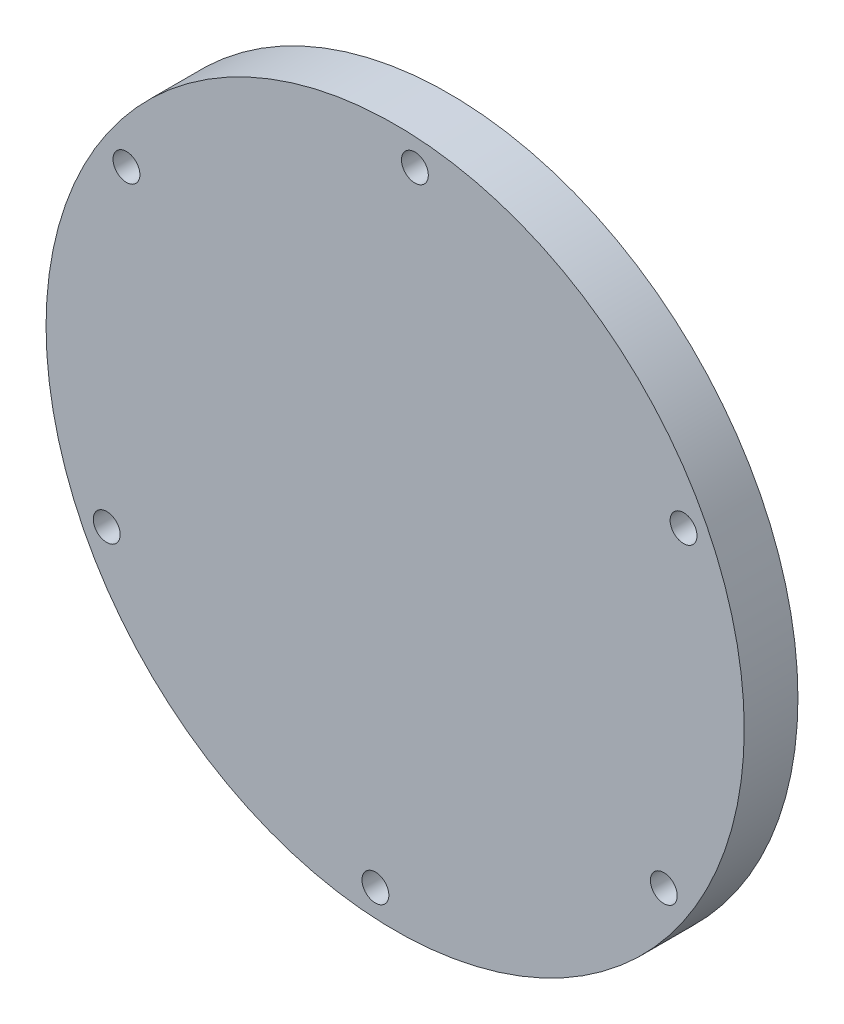
from build123d import *

# Parameters (mm, degrees)
SKETCH_1_R          = 65
SKETCH_1_R_2        = 60
SKETCH_1_R_3        = 55
EXTRUDE_1_DEPTH     = 10
CUT_EXTRUDE_1_REACH = 94.466
SKETCH_2_R          = 2.5
SKETCH_3_R          = 4
SKETCH_3_R_2        = 2.5
CUT_EXTRUDE_2_DEPTH = 5


with BuildPart() as part:
    # 草图1 → 凸台-拉伸1 (new body)
    # profile 1 of 3: a face of its own
    with BuildSketch(Plane.XY):
        Circle(SKETCH_1_R)
        Circle(SKETCH_1_R_2, mode=Mode.SUBTRACT)
    # profile 2 of 3: a face of its own
    with BuildSketch(Plane.XY):
        Circle(SKETCH_1_R_2)
        Circle(SKETCH_1_R_3, mode=Mode.SUBTRACT)
    # profile 3 of 3: a face of its own
    with BuildSketch(Plane.XY):
        Circle(SKETCH_1_R_3)
    extrude(amount=EXTRUDE_1_DEPTH)

    # 草图2 → 切除-拉伸1 (cut, up to next)
    with BuildSketch(Plane(origin=(0, 0, 0), x_dir=(-1, 0, 0), z_dir=(0, 0, -1)), mode=Mode.PRIVATE) as cut_extrude_1_sk1:
        with Locations((-3.675520948, 59.887315399)):
            Circle(SKETCH_2_R)
    cut_extrude_1_tool1 = extrude(cut_extrude_1_sk1.sketch, amount=-CUT_EXTRUDE_1_REACH, mode=Mode.PRIVATE) & part.part
    # 草图2 → 切除-拉伸1 (cut, up to next)
    with BuildSketch(Plane(origin=(0, 0, 0), x_dir=(-1, 0, 0), z_dir=(0, 0, -1)), mode=Mode.PRIVATE) as cut_extrude_1_sk2:
        with Locations((50.026176026, 33.126752213)):
            Circle(SKETCH_2_R)
    cut_extrude_1_tool2 = extrude(cut_extrude_1_sk2.sketch, amount=-CUT_EXTRUDE_1_REACH, mode=Mode.PRIVATE) & part.part
    # 草图2 → 切除-拉伸1 (cut, up to next)
    with BuildSketch(Plane(origin=(0, 0, 0), x_dir=(-1, 0, 0), z_dir=(0, 0, -1)), mode=Mode.PRIVATE) as cut_extrude_1_sk3:
        with Locations((53.701696975, -26.760563186)):
            Circle(SKETCH_2_R)
    cut_extrude_1_tool3 = extrude(cut_extrude_1_sk3.sketch, amount=-CUT_EXTRUDE_1_REACH, mode=Mode.PRIVATE) & part.part
    # 草图2 → 切除-拉伸1 (cut, up to next)
    with BuildSketch(Plane(origin=(0, 0, 0), x_dir=(-1, 0, 0), z_dir=(0, 0, -1)), mode=Mode.PRIVATE) as cut_extrude_1_sk4:
        with Locations((3.675520948, -59.887315399)):
            Circle(SKETCH_2_R)
    cut_extrude_1_tool4 = extrude(cut_extrude_1_sk4.sketch, amount=-CUT_EXTRUDE_1_REACH, mode=Mode.PRIVATE) & part.part
    # 草图2 → 切除-拉伸1 (cut, up to next)
    with BuildSketch(Plane(origin=(0, 0, 0), x_dir=(-1, 0, 0), z_dir=(0, 0, -1)), mode=Mode.PRIVATE) as cut_extrude_1_sk5:
        with Locations((-50.026176026, -33.126752213)):
            Circle(SKETCH_2_R)
    cut_extrude_1_tool5 = extrude(cut_extrude_1_sk5.sketch, amount=-CUT_EXTRUDE_1_REACH, mode=Mode.PRIVATE) & part.part
    # 草图2 → 切除-拉伸1 (cut, up to next)
    with BuildSketch(Plane(origin=(0, 0, 0), x_dir=(-1, 0, 0), z_dir=(0, 0, -1)), mode=Mode.PRIVATE) as cut_extrude_1_sk6:
        with Locations((-53.701696975, 26.760563186)):
            Circle(SKETCH_2_R)
    cut_extrude_1_tool6 = extrude(cut_extrude_1_sk6.sketch, amount=-CUT_EXTRUDE_1_REACH, mode=Mode.PRIVATE) & part.part
    add(cut_extrude_1_tool1.solids().sort_by_distance((3.675521, 59.887315, 0))[0], mode=Mode.SUBTRACT)
    add(cut_extrude_1_tool2.solids().sort_by_distance((-50.026176, 33.126752, 0))[0], mode=Mode.SUBTRACT)
    add(cut_extrude_1_tool3.solids().sort_by_distance((-53.701697, -26.760563, 0))[0], mode=Mode.SUBTRACT)
    add(cut_extrude_1_tool4.solids().sort_by_distance((-3.675521, -59.887315, 0))[0], mode=Mode.SUBTRACT)
    add(cut_extrude_1_tool5.solids().sort_by_distance((50.026176, -33.126752, 0))[0], mode=Mode.SUBTRACT)
    add(cut_extrude_1_tool6.solids().sort_by_distance((53.701697, 26.760563, 0))[0], mode=Mode.SUBTRACT)

    # 草图3 → 切除-拉伸2 (cut)
    # profile 1 of 6: a face of its own
    with BuildSketch(Plane(origin=(0, 0, 0), x_dir=(-1, 0, 0), z_dir=(0, 0, -1))):
        with Locations((-3.675520948, 59.887315399)):
            Circle(SKETCH_3_R)
        with Locations((-3.675520948, 59.887315399)):
            Circle(SKETCH_3_R_2, mode=Mode.SUBTRACT)
    # profile 2 of 6: a face of its own
    with BuildSketch(Plane(origin=(0, 0, 0), x_dir=(-1, 0, 0), z_dir=(0, 0, -1))):
        with Locations((50.026176026, 33.126752213)):
            Circle(SKETCH_3_R)
    # profile 3 of 6: a face of its own
    with BuildSketch(Plane(origin=(0, 0, 0), x_dir=(-1, 0, 0), z_dir=(0, 0, -1))):
        with Locations((53.701696975, -26.760563186)):
            Circle(SKETCH_3_R)
    # profile 4 of 6: a face of its own
    with BuildSketch(Plane(origin=(0, 0, 0), x_dir=(-1, 0, 0), z_dir=(0, 0, -1))):
        with Locations((3.675520948, -59.887315399)):
            Circle(SKETCH_3_R)
    # profile 5 of 6: a face of its own
    with BuildSketch(Plane(origin=(0, 0, 0), x_dir=(-1, 0, 0), z_dir=(0, 0, -1))):
        with Locations((-50.026176026, -33.126752213)):
            Circle(SKETCH_3_R)
    # profile 6 of 6: a face of its own
    with BuildSketch(Plane(origin=(0, 0, 0), x_dir=(-1, 0, 0), z_dir=(0, 0, -1))):
        with Locations((-53.701696975, 26.760563186)):
            Circle(SKETCH_3_R)
    extrude(amount=-CUT_EXTRUDE_2_DEPTH, mode=Mode.SUBTRACT)


solid = part.part
